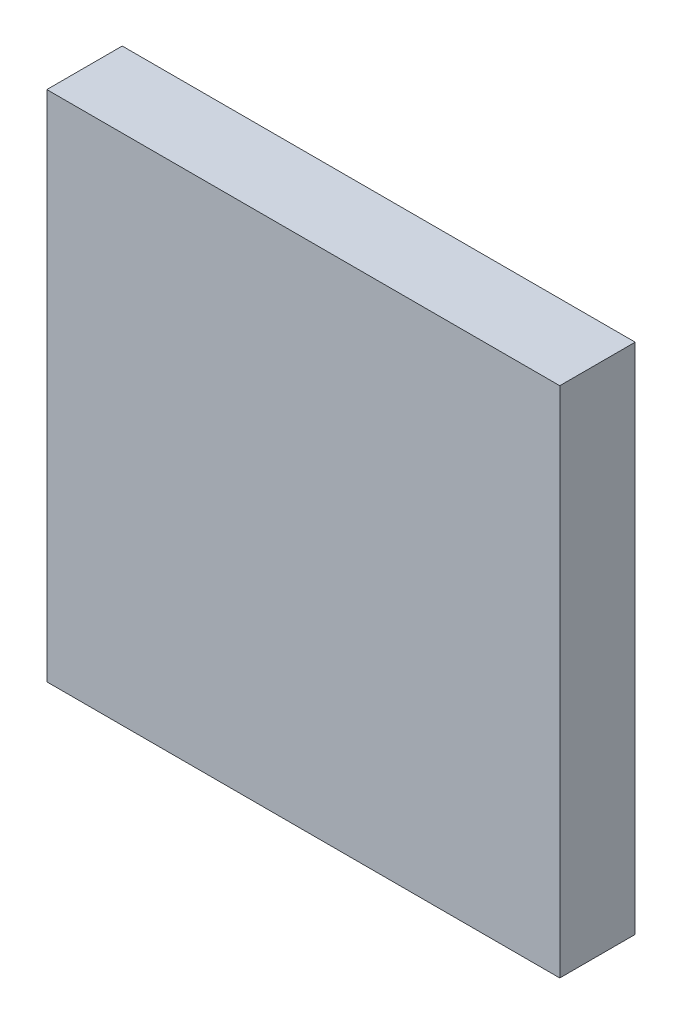
from build123d import *

# Parameters (mm, degrees)
SKETCH2_W           = 34
SKETCH2_H           = 34
BOSS_EXTRUDE1_DEPTH = 5


with BuildPart() as part:
    # Sketch2 → Boss-Extrude1 (new body)
    with BuildSketch(Plane.XY):
        Rectangle(SKETCH2_W, SKETCH2_H)
    extrude(amount=BOSS_EXTRUDE1_DEPTH)


solid = part.part
